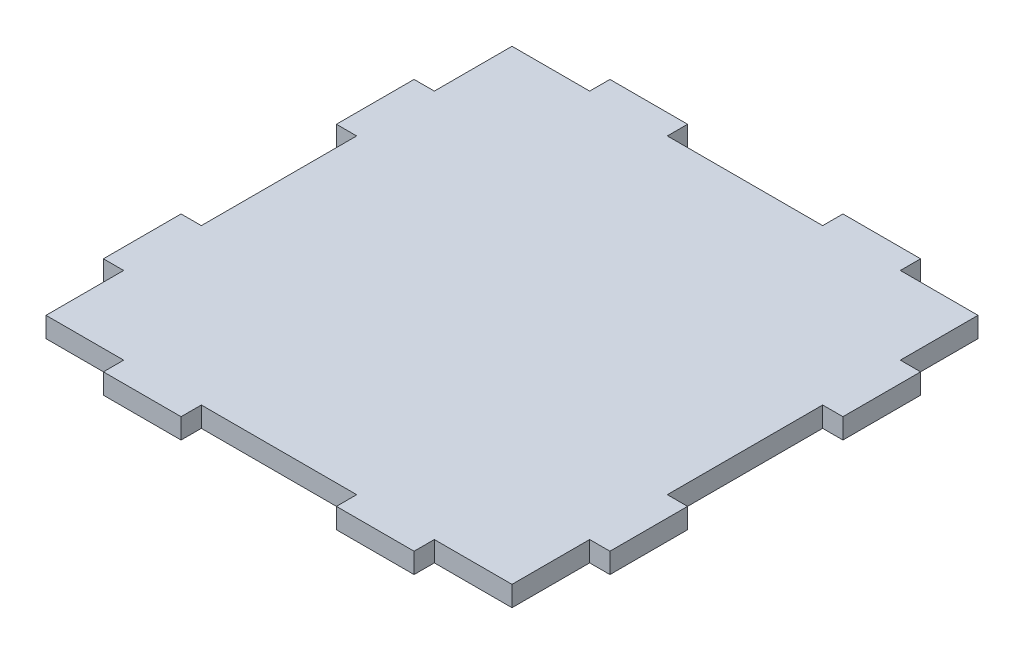
from build123d import *

# Parameters (mm, degrees)
BOSS_EXTRUDE1_DEPTH = 6


with BuildPart() as part:
    # Sketch1 → Boss-Extrude1 (new body)
    with BuildSketch(Plane(origin=(0, 0, 0), x_dir=(1, 0, 0), z_dir=(0, 1, 0))):
        Polygon((0, 69), (-23, 69), (-23, 75), (-46, 75), (-46, 69), (-69, 69), (-69, 46), (-75, 46), (-75, 23), (-69, 23), (-69, 0), (-69, -23), (-75, -23), (-75, -46), (-69, -46), (-69, -69), (-46, -69), (-46, -75), (-23, -75), (-23, -69), (0, -69), (23, -69), (23, -75), (46, -75), (46, -69), (69, -69), (69, -46), (75, -46), (75, -23), (69, -23), (69, 0), (69, 23), (75, 23), (75, 46), (69, 46), (69, 69), (46, 69), (46, 75), (23, 75), (23, 69), align=None)
    extrude(amount=BOSS_EXTRUDE1_DEPTH)


solid = part.part
